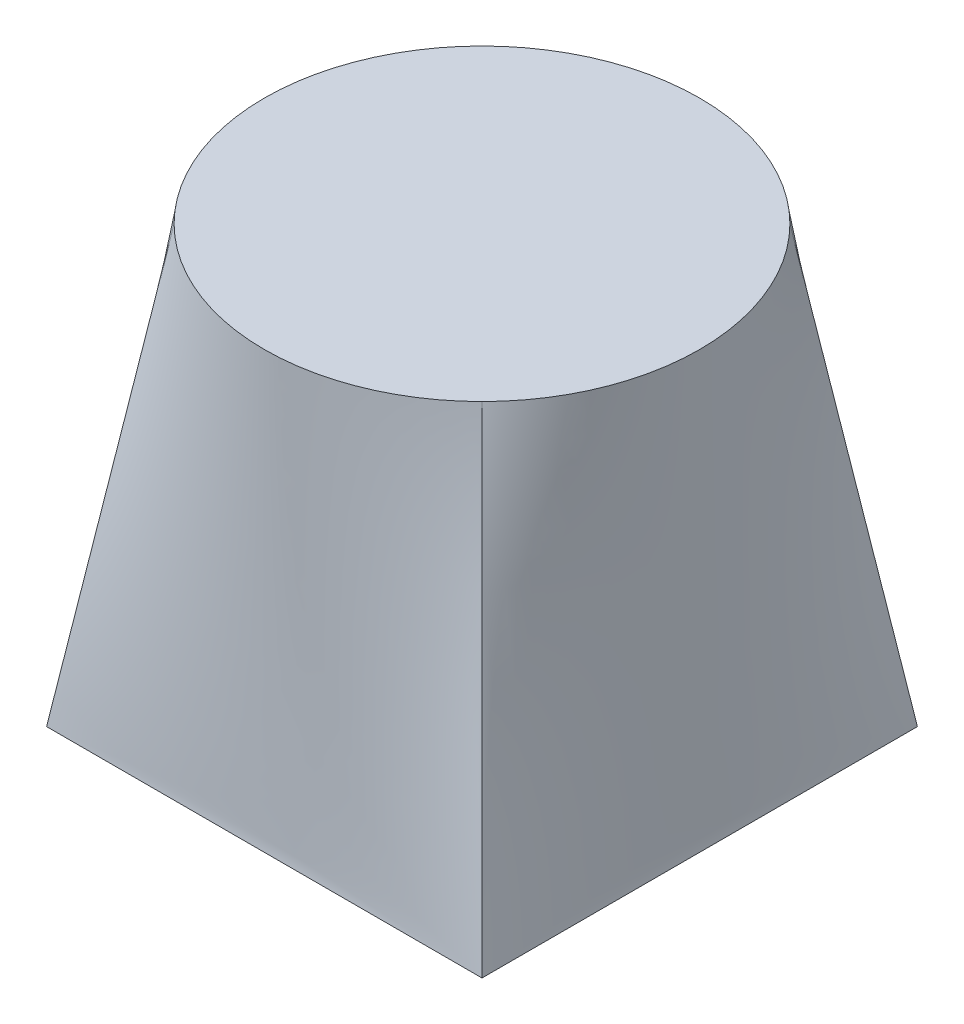
from build123d import *


with BuildPart() as part:
    # Sketch1 → Loft1 section 0
    with BuildSketch(Plane(origin=(0, 0, 0), x_dir=(1, 0, 0), z_dir=(0, 1, 0))):
        with BuildLine():
            Line((-5, -5), (5, -5))
            Line((5, -5), (5, 5))
            Line((5, 5), (-5, 5))
            Line((-5, 5), (-5, -5))
        make_face()
    # Sketch2 for Loft1 → Loft1 section 1
    with BuildSketch(Plane(origin=(0, 10, 0), x_dir=(-1, 0, 0), z_dir=(0, 1, 0))):
        with BuildLine():
            # circular arc as an exact rational Bezier (weights 1, cos(half-angle), 1)
            Bezier((3.535533906, 3.535533906), (0, 7.071067812), (-3.535533906, 3.535533906), weights=[1, 0.707106781, 1])
            Bezier((-3.535533906, 3.535533906), (-7.071067812, 0), (-3.535533906, -3.535533906), weights=[1, 0.707106781, 1])
            Bezier((-3.535533906, -3.535533906), (0, -7.071067812), (3.535533906, -3.535533906), weights=[1, 0.707106781, 1])
            Bezier((3.535533906, -3.535533906), (7.071067812, 0), (3.535533906, 3.535533906), weights=[1, 0.707106781, 1])
        make_face()
    loft()


solid = part.part
